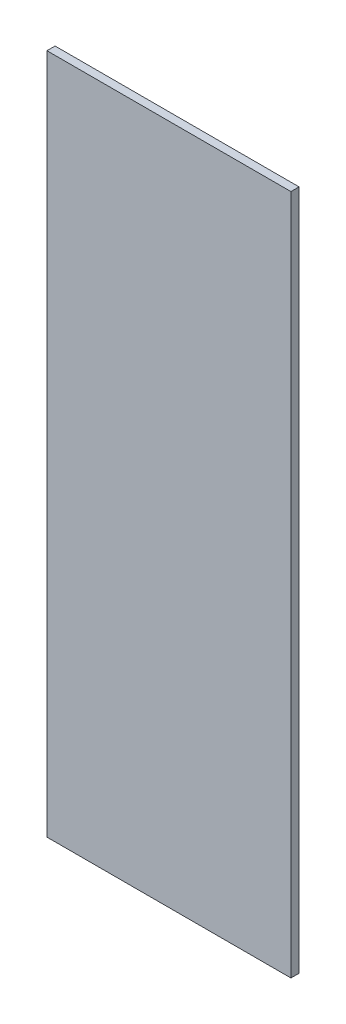
from build123d import *

# Parameters (mm, degrees)
SKETCH_1_W      = 150
SKETCH_1_H      = 5
EXTRUDE_1_DEPTH = 418.713673317


with BuildPart() as part:
    # Эскиз1 → Вытянуть1 (new body)
    with BuildSketch(Plane(origin=(0, 0, 0), x_dir=(1, 0, 0), z_dir=(0, 1, 0))):
        with Locations((75, -2.5)):
            Rectangle(SKETCH_1_W, SKETCH_1_H)
    extrude(amount=EXTRUDE_1_DEPTH)


solid = part.part
